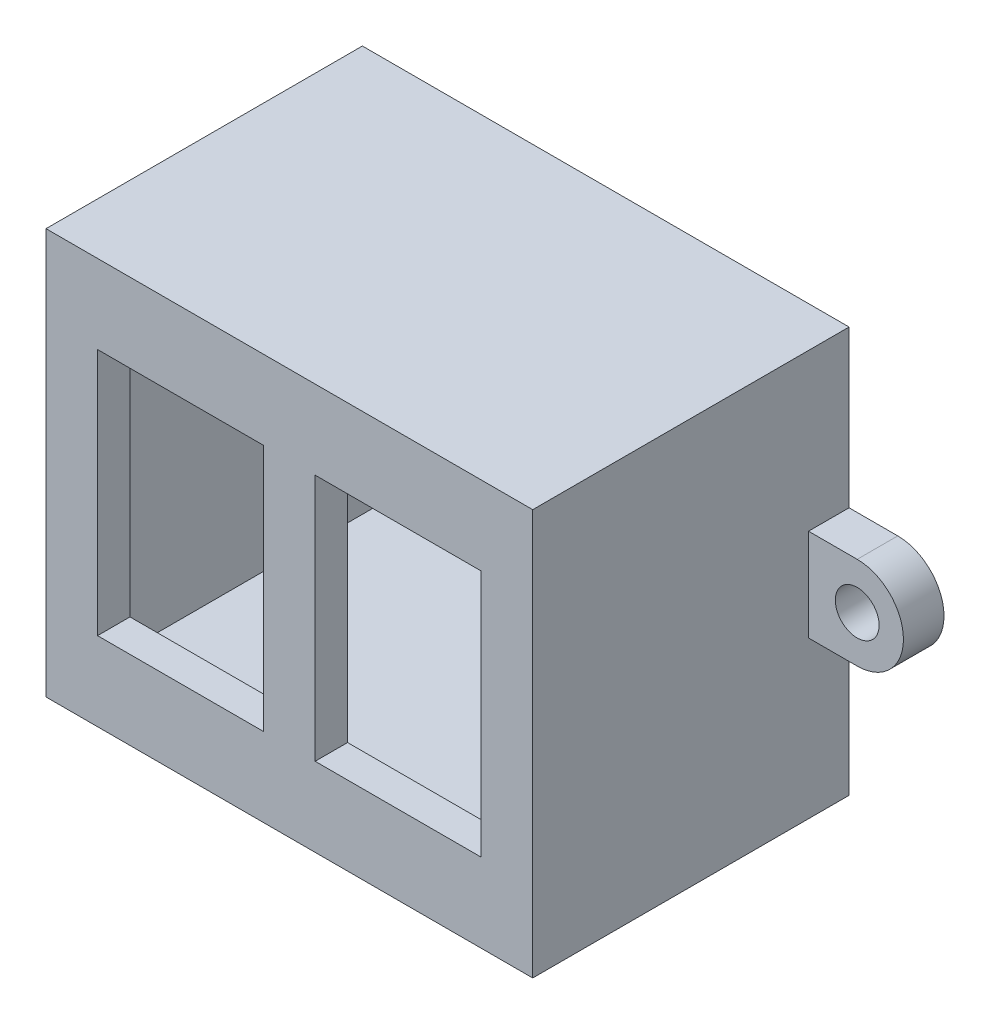
from build123d import *

# Parameters (mm, degrees)
SKETCH1_W           = 38.1
SKETCH1_H           = 31.75
SKETCH1_W_2         = 13
SKETCH1_H_2         = 19.4
BOSS_EXTRUDE1_DEPTH = 2.54
SKETCH2_W           = 38.1
SKETCH2_H           = 31.75
SKETCH2_W_2         = 33.02
SKETCH2_H_2         = 26.67
BOSS_EXTRUDE2_DEPTH = 22.225
SKETCH3_R           = 1.7145
BOSS_EXTRUDE3_DEPTH = 3.175
CUT_EXTRUDE1_REACH  = 61.791


with BuildPart() as part:
    # Sketch1 → Boss-Extrude1 (new body)
    with BuildSketch(Plane.XY):
        with Locations((19.05, 15.875)):
            Rectangle(SKETCH1_W, SKETCH1_H)
        with Locations((10.533333333, 15.875)):
            Rectangle(SKETCH1_W_2, SKETCH1_H_2, mode=Mode.SUBTRACT)
        with Locations((27.566666667, 15.875)):
            Rectangle(SKETCH1_W_2, SKETCH1_H_2, mode=Mode.SUBTRACT)
    extrude(amount=BOSS_EXTRUDE1_DEPTH)

    # Sketch2 → Boss-Extrude2 (add)
    with BuildSketch(Plane(origin=(0, 0, 0), x_dir=(-1, 0, 0), z_dir=(0, 0, -1))):
        with Locations((-19.05, 15.875)):
            Rectangle(SKETCH2_W, SKETCH2_H)
        with Locations((-19.05, 15.875)):
            Rectangle(SKETCH2_W_2, SKETCH2_H_2, mode=Mode.SUBTRACT)
    extrude(amount=BOSS_EXTRUDE2_DEPTH)

    # Sketch3 → Boss-Extrude3 (add)
    # profile 1 of 2: a face of its own
    with BuildSketch(Plane(origin=(0, 0, -22.225), x_dir=(-1, 0, 0), z_dir=(0, 0, -1))):
        with BuildLine():
            Line((-41.91, 19.4945), (-38.1, 19.4945))
            Line((-38.1, 19.4945), (-38.1, 12.2555))
            Line((-38.1, 12.2555), (-41.91, 12.2555))
            ThreePointArc((-41.91, 12.2555), (-45.5295, 15.875), (-41.91, 19.4945))
        make_face()
        with Locations((-41.91, 15.875)):
            Circle(SKETCH3_R, mode=Mode.SUBTRACT)
    # profile 2 of 2: a face of its own
    with BuildSketch(Plane(origin=(0, 0, -22.225), x_dir=(-1, 0, 0), z_dir=(0, 0, -1))):
        with BuildLine():
            Line((3.81, 12.2555), (0, 12.2555))
            Line((0, 12.2555), (0, 19.4945))
            Line((0, 19.4945), (3.81, 19.4945))
            ThreePointArc((3.81, 19.4945), (7.4295, 15.875), (3.81, 12.2555))
        make_face()
        with Locations((3.81, 15.875)):
            Circle(SKETCH3_R, mode=Mode.SUBTRACT)
    extrude(amount=-BOSS_EXTRUDE3_DEPTH)

    # Sketch4 → Cut-Extrude1 (cut, up to next)
    with BuildSketch(Plane.XZ, mode=Mode.PRIVATE) as cut_extrude1_sk1:
        with BuildLine():
            Line((22.225, -19.05), (22.225, -22.225))
            Line((22.225, -22.225), (15.875, -22.225))
            Line((15.875, -22.225), (15.875, -19.05))
            ThreePointArc((15.875, -19.05), (19.05, -15.875), (22.225, -19.05))
        make_face()
    cut_extrude1_tool1 = extrude(cut_extrude1_sk1.sketch, amount=-CUT_EXTRUDE1_REACH, mode=Mode.PRIVATE) & part.part
    add(cut_extrude1_tool1.solids().sort_by_distance((19.05, 0, -19.346386))[0], mode=Mode.SUBTRACT)


solid = part.part
